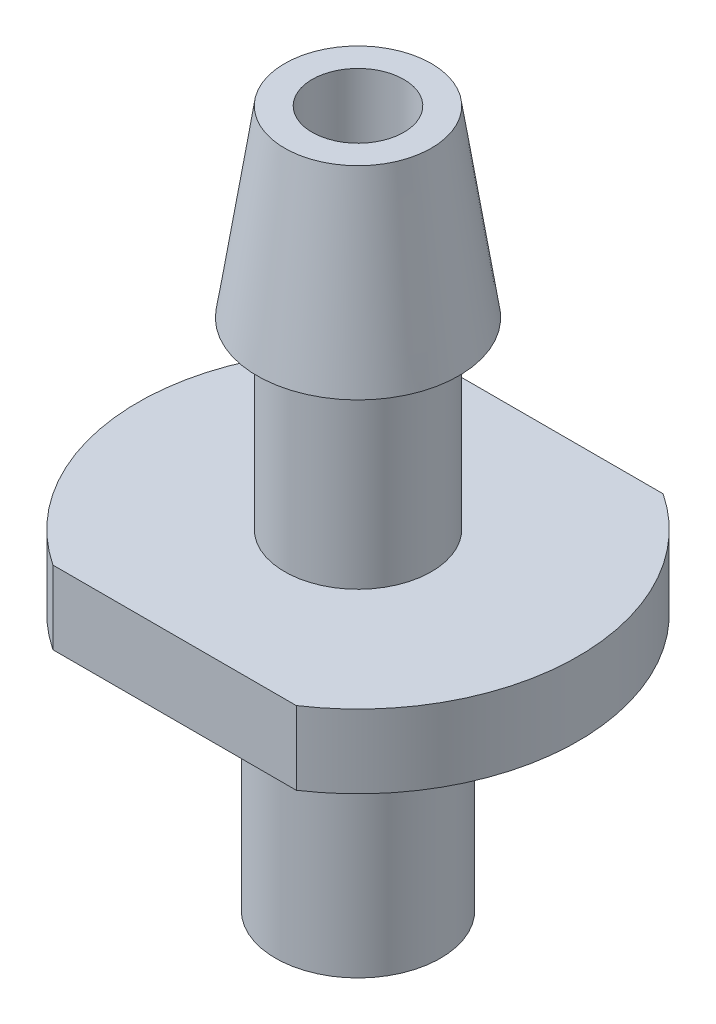
from build123d import *

# Parameters (mm, degrees)
SKETCH_2_W          = 11.803502198
SKETCH_2_H          = 1.437820381
CUT_EXTRUDE_1_DEPTH = 10


with BuildPart() as part:
    # Эскиз1 → Повернуть1 (revolve)
    with BuildSketch(Plane.XY, mode=Mode.PRIVATE) as revolve_1_sk:
        Polygon((-1.25, 0), (-2.25, 0), (-2.25, 7), (-6, 7), (-6, 9), (-2, 9), (-2, 14), (-2.75, 14), (-2, 19), (-1.25, 19), align=None)
    revolve(revolve_1_sk.sketch.rotate(Axis((0, 0, 0), (0, 1, 0)), 270), axis=Axis((0, 0, 0), (0, 1, 0)))

    # Эскиз2 → Вырез-Вытянуть1 (cut)
    with BuildSketch(Plane(origin=(0, 9, 0), x_dir=(1, 0, 0), z_dir=(0, 1, 0))):
        with Locations((0, -5.718910191)):
            Rectangle(SKETCH_2_W, SKETCH_2_H)
        with Locations((0, 5.718910191)):
            Rectangle(SKETCH_2_W, SKETCH_2_H)
    extrude(amount=-CUT_EXTRUDE_1_DEPTH, mode=Mode.SUBTRACT)


solid = part.part
